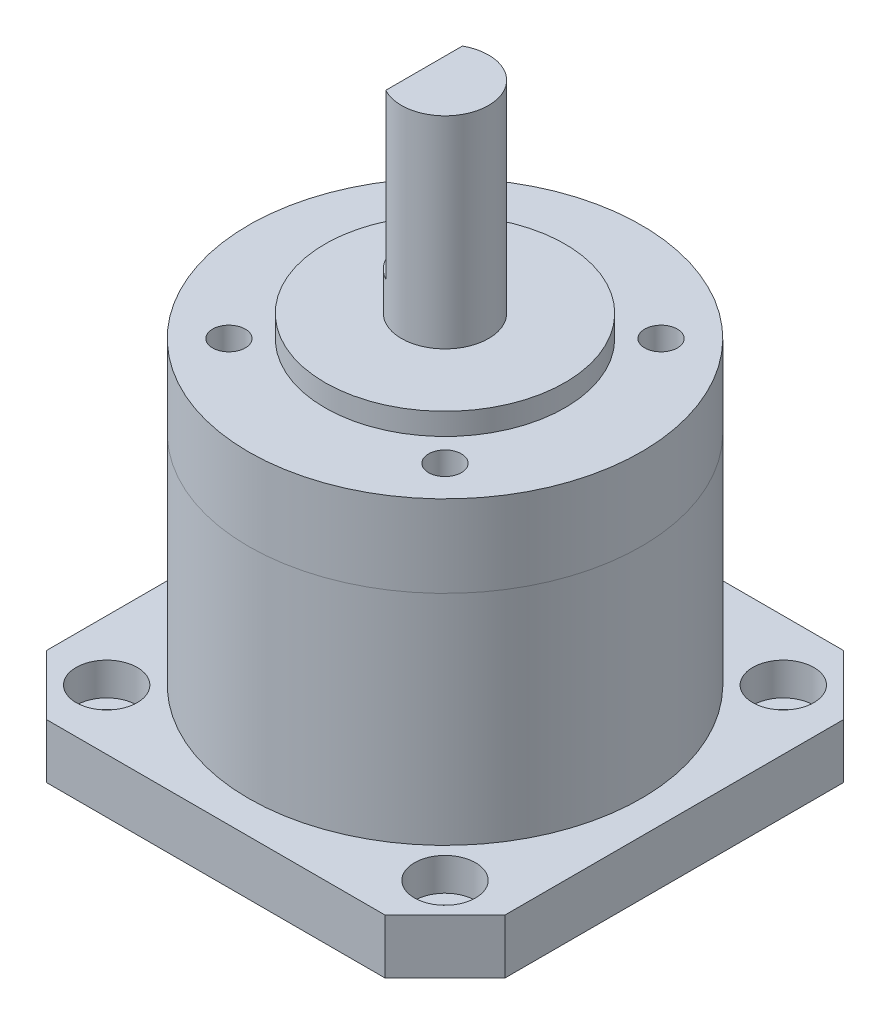
from build123d import *

# Parameters (mm, degrees)
SKETCH_1_W          = 42
SKETCH_1_H          = 42
EXTRUDE_1_DEPTH     = 5
CHAMFER_1_SIZE      = 5.5
SKETCH_2_R          = 1.5
CUT_EXTRUDE_1_DEPTH = 5
SKETCH_3_R          = 18
EXTRUDE_2_DEPTH     = 27.5
SKETCH_4_R          = 1.5
CUT_EXTRUDE_2_DEPTH = 4
SKETCH_6_R          = 11
EXTRUDE_3_DEPTH     = 2
SKETCH_7_R          = 4
EXTRUDE_4_DEPTH     = 18.5
SKETCH_8_R          = 11
CUT_EXTRUDE_3_DEPTH = 3
SKETCH_9_R          = 8
CUT_EXTRUDE_4_DEPTH = 10
CUT_EXTRUDE_START   = -15
CUT_EXTRUDE_5_DEPTH = 15
SKETCH_12_R         = 2.8
CUT_EXTRUDE_6_DEPTH = 3


with BuildPart() as part:
    # 草图1 → 凸台-拉伸1 (new body)
    with BuildSketch(Plane(origin=(0, 0, 0), x_dir=(1, 0, 0), z_dir=(0, 1, 0))):
        Rectangle(SKETCH_1_W, SKETCH_1_H)
    extrude(amount=EXTRUDE_1_DEPTH)

    # 倒角1
    chamfer_1_edges = [part.edges().sort_by_distance(p)[0] for p in [
        (21, 2.5, 21),
        (-21, 2.5, 21),
        (-21, 2.5, -21),
        (21, 2.5, -21),
    ]]
    chamfer(chamfer_1_edges, length=CHAMFER_1_SIZE)

    # 草图2 → 切除-拉伸1 (cut)
    with BuildSketch(Plane.XZ):
        with Locations(Location((-15.5, 15.5, 0), (0, 0, 270))):
            Circle(SKETCH_2_R)
        with Locations(Location((15.5, 15.5, 0), (0, 0, 270))):
            Circle(SKETCH_2_R)
        with Locations(Location((15.5, -15.5, 0), (0, 0, 270))):
            Circle(SKETCH_2_R)
        with Locations(Location((-15.5, -15.5, 0), (0, 0, 270))):
            Circle(SKETCH_2_R)
    extrude(amount=-CUT_EXTRUDE_1_DEPTH, mode=Mode.SUBTRACT)

    # 草图3 → 凸台-拉伸2 (add)
    with BuildSketch(Plane(origin=(0, 5, 0), x_dir=(1, 0, 0), z_dir=(0, 1, 0))):
        with Locations(Location((0, 0, 0), (0, 0, 270))):
            Circle(SKETCH_3_R)
    extrude(amount=EXTRUDE_2_DEPTH)

    # 草图4 → 切除-拉伸2 (cut)
    with BuildSketch(Plane(origin=(0, 32.5, 0), x_dir=(1, 0, 0), z_dir=(0, 1, 0))):
        with Locations(Location((-9.899494937, 9.899494937, 0), (0, 0, 270))):
            Circle(SKETCH_4_R)
        with Locations(Location((9.899494937, 9.899494937, 0), (0, 0, 270))):
            Circle(SKETCH_4_R)
        with Locations(Location((9.899494937, -9.899494937, 0), (0, 0, 270))):
            Circle(SKETCH_4_R)
        with Locations(Location((-9.899494937, -9.899494937, 0), (0, 0, 270))):
            Circle(SKETCH_4_R)
    extrude(amount=-CUT_EXTRUDE_2_DEPTH, mode=Mode.SUBTRACT)

    # 草图6 → 凸台-拉伸3 (add)
    with BuildSketch(Plane(origin=(0, 32.5, 0), x_dir=(1, 0, 0), z_dir=(0, 1, 0))):
        with Locations(Location((0, 0, 0), (0, 0, 270))):
            Circle(SKETCH_6_R)
    extrude(amount=EXTRUDE_3_DEPTH)

    # 草图7 → 凸台-拉伸4 (add)
    with BuildSketch(Plane(origin=(0, 34.5, 0), x_dir=(1, 0, 0), z_dir=(0, 1, 0))):
        with Locations(Location((0, 0, 0), (0, 0, 270))):
            Circle(SKETCH_7_R)
    extrude(amount=EXTRUDE_4_DEPTH)

    # 草图8 → 切除-拉伸3 (cut)
    with BuildSketch(Plane.XZ):
        with Locations(Location((0, 0, 0), (0, 0, 90))):
            Circle(SKETCH_8_R)
    extrude(amount=-CUT_EXTRUDE_3_DEPTH, mode=Mode.SUBTRACT)

    # 草图9 → 切除-拉伸4 (cut)
    with BuildSketch(Plane.XZ.offset(-3)):
        with Locations(Location((0, 0, 0), (0, 0, 270))):
            Circle(SKETCH_9_R)
    extrude(amount=-CUT_EXTRUDE_4_DEPTH, mode=Mode.SUBTRACT)

    # 草图11 → 切除-拉伸5 (cut)
    with BuildSketch(Plane(origin=(0, 53, 0), x_dir=(1, 0, 0), z_dir=(0, 1, 0)).offset(CUT_EXTRUDE_START)):
        with BuildLine():
            Line((-1.914185744, -3.512248986), (-1.914185744, 3.512248986))
            ThreePointArc((-1.914185744, 3.512248986), (-4, 0), (-1.914185744, -3.512248986))
        make_face()
    extrude(amount=CUT_EXTRUDE_5_DEPTH, mode=Mode.SUBTRACT)

    # 草图12 → 切除-拉伸6 (cut)
    with BuildSketch(Plane(origin=(0, 5, 0), x_dir=(1, 0, 0), z_dir=(0, 1, 0))):
        with Locations(Location((-15.5, 15.5, 0), (0, 0, 270))):
            Circle(SKETCH_12_R)
        with Locations(Location((15.5, 15.5, 0), (0, 0, 270))):
            Circle(SKETCH_12_R)
        with Locations(Location((-15.5, -15.5, 0), (0, 0, 270))):
            Circle(SKETCH_12_R)
        with Locations(Location((15.5, -15.5, 0), (0, 0, 270))):
            Circle(SKETCH_12_R)
    extrude(amount=-CUT_EXTRUDE_6_DEPTH, mode=Mode.SUBTRACT)


solid = part.part
